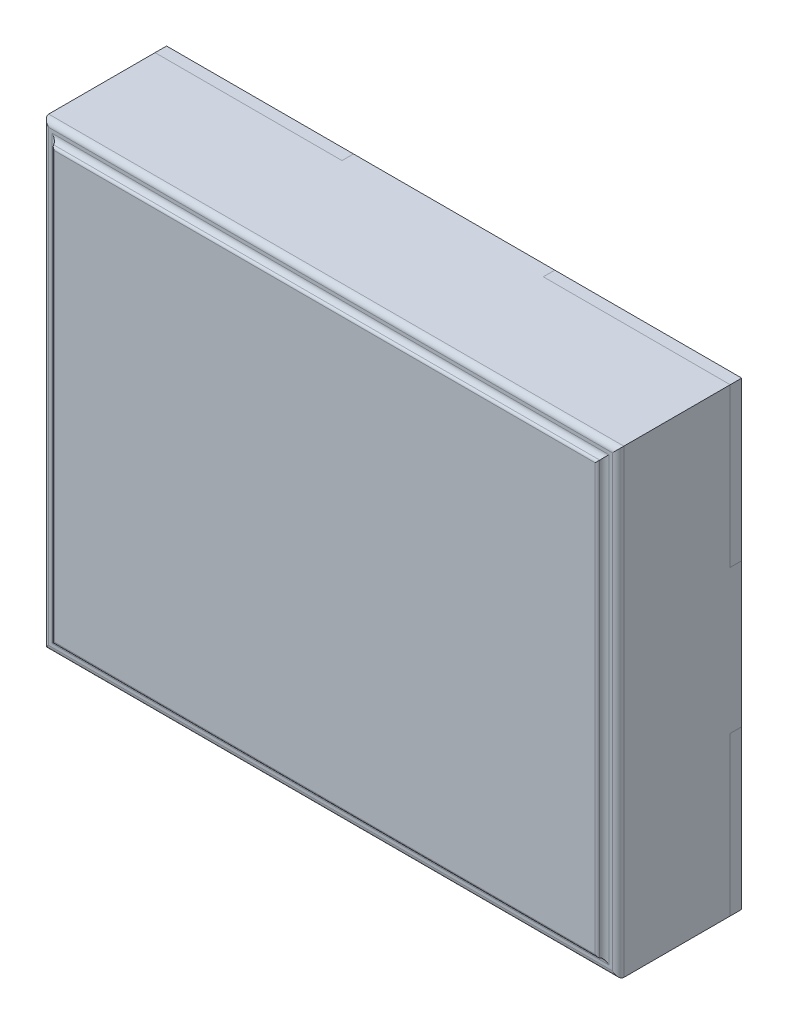
from build123d import *

# Parameters (mm, degrees)
SKETCH1_W             = 0.65
SKETCH1_H             = 0.55
BOSS_EXTRUDE1_DEPTH   = 0.04
BOSS_EXTRUDE1_2_DEPTH = 0.04
BOSS_EXTRUDE1_3_DEPTH = 0.04
BOSS_EXTRUDE1_4_DEPTH = 0.04
BOSS_EXTRUDE2_DEPTH   = 0.43
BOSS_EXTRUDE3_START   = 0.04
SKETCH1_4_W           = 0.65
SKETCH1_4_H           = 0.55
BOSS_EXTRUDE3_DEPTH   = 0.39
BOSS_EXTRUDE3_2_DEPTH = 0.39
BOSS_EXTRUDE3_3_DEPTH = 0.39
BOSS_EXTRUDE3_4_DEPTH = 0.39
SKETCH2_W             = 1.9
SKETCH2_H             = 1.5
BOSS_EXTRUDE4_DEPTH   = 0.02
FILLET1_R             = 0.01
FILLET4_R             = 0.02


with BuildPart() as part:
    # Sketch1 → Boss-Extrude1 (new body)
    with BuildSketch(Plane.XY):
        with Locations((-0.675, -0.525)):
            Rectangle(SKETCH1_W, SKETCH1_H)
    extrude(amount=BOSS_EXTRUDE1_DEPTH)


with BuildPart() as body_2:
    # Sketch1 → Boss-Extrude1 2 (new body)
    with BuildSketch(Plane.XY):
        with Locations((0.675, -0.525)):
            Rectangle(SKETCH1_W, SKETCH1_H)
    extrude(amount=BOSS_EXTRUDE1_2_DEPTH)


with BuildPart() as body_3:
    # Sketch1 → Boss-Extrude1 3 (new body)
    with BuildSketch(Plane.XY):
        with Locations((-0.675, 0.525)):
            Rectangle(SKETCH1_W, SKETCH1_H)
    extrude(amount=BOSS_EXTRUDE1_3_DEPTH)


with BuildPart() as body_4:
    # Sketch1 → Boss-Extrude1 4 (new body)
    with BuildSketch(Plane.XY):
        with Locations((0.675, 0.525)):
            Rectangle(SKETCH1_W, SKETCH1_H)
    extrude(amount=BOSS_EXTRUDE1_4_DEPTH)


with BuildPart() as body_5:
    # Sketch1<3> → Boss-Extrude2 (new body)
    with BuildSketch(Plane.XY):
        Polygon((-0.35, -0.25), (-0.35, -0.8), (0.35, -0.8), (0.35, -0.25), (1, -0.25), (1, 0.25), (0.35, 0.25), (0.35, 0.8), (-0.35, 0.8), (-0.35, 0.25), (-1, 0.25), (-1, -0.25), align=None)
    extrude(amount=BOSS_EXTRUDE2_DEPTH)



with BuildPart() as body_6:
    # Sketch1<4> → Boss-Extrude3 (new body)
    with BuildSketch(Plane.XY.offset(BOSS_EXTRUDE3_START)):
        with Locations((-0.675, -0.525)):
            Rectangle(SKETCH1_4_W, SKETCH1_4_H)
    extrude(amount=BOSS_EXTRUDE3_DEPTH)


with BuildPart() as body_7:
    # Sketch1<4> → Boss-Extrude3 2 (new body)
    with BuildSketch(Plane.XY.offset(BOSS_EXTRUDE3_START)):
        with Locations((0.675, -0.525)):
            Rectangle(SKETCH1_4_W, SKETCH1_4_H)
    extrude(amount=BOSS_EXTRUDE3_2_DEPTH)


with BuildPart() as body_8:
    # Sketch1<4> → Boss-Extrude3 3 (new body)
    with BuildSketch(Plane.XY.offset(BOSS_EXTRUDE3_START)):
        with Locations((-0.675, 0.525)):
            Rectangle(SKETCH1_4_W, SKETCH1_4_H)
    extrude(amount=BOSS_EXTRUDE3_3_DEPTH)


with BuildPart() as body_9:
    # Sketch1<4> → Boss-Extrude3 4 (new body)
    with BuildSketch(Plane.XY.offset(BOSS_EXTRUDE3_START)):
        with Locations((0.675, 0.525)):
            Rectangle(SKETCH1_4_W, SKETCH1_4_H)
    extrude(amount=BOSS_EXTRUDE3_4_DEPTH)


with BuildPart() as body_5_1:
    add(body_5.part)

    add(body_6.part)  # Boss-Extrude4 merges body 6

    add(body_7.part)  # Boss-Extrude4 merges body 7

    add(body_8.part)  # Boss-Extrude4 merges body 8

    add(body_9.part)  # Boss-Extrude4 merges body 9
    # Sketch2 → Boss-Extrude4 (add)
    with BuildSketch(Plane.XY.offset(0.43)):
        Rectangle(SKETCH2_W, SKETCH2_H)
    extrude(amount=BOSS_EXTRUDE4_DEPTH)

    # Fillet1
    fillet1_edges = [body_5_1.edges().sort_by_distance(p)[0] for p in [
        (0, -0.75, 0.45),
        (-0.95, 0, 0.45),
        (0, 0.75, 0.45),
        (0.95, 0, 0.45),
    ]]
    fillet(fillet1_edges, radius=FILLET1_R)

    # Fillet4
    fillet4_edges = [body_5_1.edges().sort_by_distance(p)[0] for p in [
        (-0.95, 0, 0.43),
        (0, -0.75, 0.43),
        (0.95, 0, 0.43),
        (0, 0.75, 0.43),
        (0, 0.8, 0.43),
        (1, 0, 0.43),
        (0, -0.8, 0.43),
        (-1, 0, 0.43),
    ]]
    fillet(fillet4_edges, radius=FILLET4_R)


solid = Compound([part.part, body_2.part, body_3.part, body_4.part, body_5_1.part])
